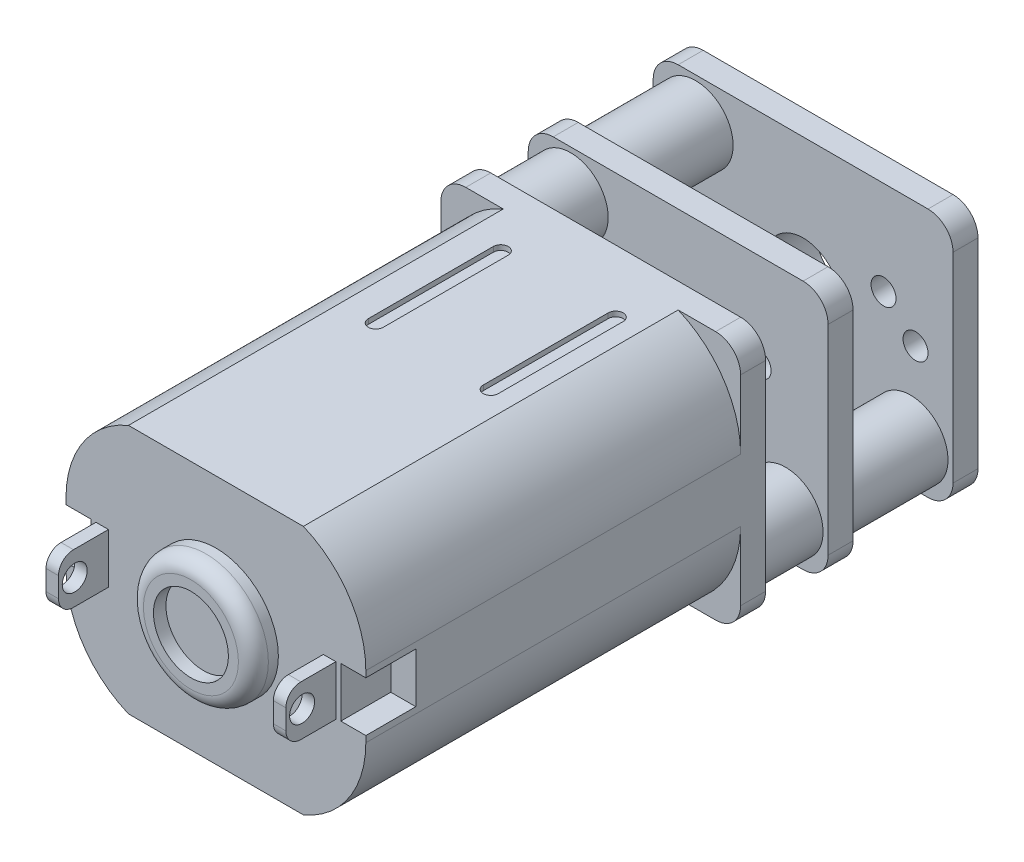
from build123d import *

# Parameters (mm, degrees)
BOSS_EXTRUDE1_DEPTH  = 15
SKETCH2_W            = 12
SKETCH2_H            = 10
BOSS_EXTRUDE2_DEPTH  = 1
FILLET1_R            = 1
SKETCH3_R            = 1
BOSS_EXTRUDE3_DEPTH  = 2
SKETCH4_R            = 1.5
BOSS_EXTRUDE4_DEPTH  = 2.5
SKETCH12_R           = 2.5
BOSS_EXTRUDE11_DEPTH = 1
SKETCH13_R           = 1.5
CUT_EXTRUDE4_DEPTH   = 0.5
FILLET5_R            = 0.6
SKETCH15_W           = 1
SKETCH15_H           = 2
CUT_EXTRUDE5_DEPTH   = 2
CUT_EXTRUDE6_DEPTH   = 0.2
CUT_EXTRUDE7_START   = -0.2
CUT_EXTRUDE7_DEPTH   = 0.2
SKETCH31_W           = 0.5
SKETCH31_H           = 2
BOSS_EXTRUDE16_DEPTH = 2
FILLET9_R            = 0.6
SKETCH32_R           = 0.5
CUT_EXTRUDE10_DEPTH  = 2
CUT_EXTRUDE11_START  = -2
SKETCH33_R           = 0.5
CUT_EXTRUDE11_DEPTH  = 2
BOSS_EXTRUDE17_DEPTH = 1
FILLET10_R           = 1
SKETCH34_R           = 1.5
BOSS_EXTRUDE18_DEPTH = 4
SKETCH35_W           = 12
SKETCH35_H           = 10
BOSS_EXTRUDE19_DEPTH = 1
SKETCH36_R           = 2
BOSS_EXTRUDE20_DEPTH = 1
CUT_EXTRUDE12_START  = -2
SKETCH37_R           = 1.5
CUT_EXTRUDE12_DEPTH  = 2
FILLET11_R           = 1
SKETCH38_R           = 0.5
CUT_EXTRUDE13_DEPTH  = 2
SKETCH39_R           = 0.75
CUT_EXTRUDE14_DEPTH  = 9.3
CHAMFER1_SIZE        = 0.3
SKETCH40_R           = 0.5
CUT_EXTRUDE15_DEPTH  = 1
SKETCH41_R           = 0.5
CUT_EXTRUDE16_DEPTH  = 1
SKETCH42_R           = 0.5
CUT_EXTRUDE17_DEPTH  = 1
SKETCH43_R           = 0.5
CUT_EXTRUDE18_DEPTH  = 1


with BuildPart() as part:
    # Sketch1 → Boss-Extrude1 (new body)
    with BuildSketch(Plane.XY):
        with BuildLine():
            Line((-6, -1.25), (-6, 1.25))
            ThreePointArc((-6, 1.25), (-5.317704321, 3.503469547), (-3.5, 5))
            Line((-3.5, 5), (3.5, 5))
            ThreePointArc((3.5, 5), (5.317704321, 3.503469547), (6, 1.25))
            Line((6, 1.25), (6, -1.25))
            ThreePointArc((6, -1.25), (5.317704321, -3.503469547), (3.5, -5))
            Line((3.5, -5), (-3.5, -5))
            ThreePointArc((-3.5, -5), (-5.317704321, -3.503469547), (-6, -1.25))
        make_face()
    extrude(amount=-BOSS_EXTRUDE1_DEPTH)

    # Sketch2 → Boss-Extrude2 (add)
    with BuildSketch(Plane(origin=(0, 0, -15), x_dir=(-1, 0, 0), z_dir=(0, 0, -1))):
        Rectangle(SKETCH2_W, SKETCH2_H)
    extrude(amount=BOSS_EXTRUDE2_DEPTH)

    # Fillet1
    fillet1_edges = [part.edges().sort_by_distance(p)[0] for p in [
        (6, 5, -15.5),
        (6, -5, -15.5),
        (-6, -5, -15.5),
        (-6, 5, -15.5),
    ]]
    fillet(fillet1_edges, radius=FILLET1_R)

    # Sketch3 → Boss-Extrude3 (add)
    with BuildSketch(Plane(origin=(0, 0, -16), x_dir=(-1, 0, 0), z_dir=(0, 0, -1))):
        Circle(SKETCH3_R)
    extrude(amount=BOSS_EXTRUDE3_DEPTH)

    # Sketch4 → Boss-Extrude4 (add)
    with BuildSketch(Plane(origin=(0, 0, -16), x_dir=(-1, 0, 0), z_dir=(0, 0, -1))):
        with Locations((4.3, 3.3)):
            Circle(SKETCH4_R)
        with Locations((-4.3, -3.3)):
            Circle(SKETCH4_R)
    extrude(amount=BOSS_EXTRUDE4_DEPTH)

    # Sketch12 → Boss-Extrude11 (add)
    with BuildSketch(Plane.XY):
        Circle(SKETCH12_R)
    extrude(amount=BOSS_EXTRUDE11_DEPTH)

    # Sketch13 → Cut-Extrude4 (cut)
    with BuildSketch(Plane.XY.offset(1)):
        Circle(SKETCH13_R)
    extrude(amount=-CUT_EXTRUDE4_DEPTH, mode=Mode.SUBTRACT)

    # Fillet5
    fillet5_edges = [part.edges().sort_by_distance(p)[0] for p in [
        (-2.5, 0, 1),
    ]]
    fillet(fillet5_edges, radius=FILLET5_R)

    # Sketch15 → Cut-Extrude5 (cut)
    with BuildSketch(Plane.XY):
        with Locations((-5.5, 0)):
            Rectangle(SKETCH15_W, SKETCH15_H)
        with Locations((5.5, 0)):
            Rectangle(SKETCH15_W, SKETCH15_H)
    extrude(amount=-CUT_EXTRUDE5_DEPTH, mode=Mode.SUBTRACT)

    # Sketch22 → Cut-Extrude6 (cut)
    with BuildSketch(Plane(origin=(0, 5, 0), x_dir=(1, 0, 0), z_dir=(0, 1, 0))):
        with BuildLine():
            Line((-2.4, 8.5), (-2.4, 13.5))
            ThreePointArc((-2.4, 13.5), (-2.1, 13.8), (-1.8, 13.5))
            Line((-1.8, 13.5), (-1.8, 8.5))
            ThreePointArc((-1.8, 8.5), (-2.1, 8.2), (-2.4, 8.5))
        make_face()
        with BuildLine():
            Line((2.2, 8.5), (2.2, 13.5))
            ThreePointArc((2.2, 13.5), (2.5, 13.8), (2.8, 13.5))
            Line((2.8, 13.5), (2.8, 8.5))
            ThreePointArc((2.8, 8.5), (2.5, 8.2), (2.2, 8.5))
        make_face()
    extrude(amount=-CUT_EXTRUDE6_DEPTH, mode=Mode.SUBTRACT)

    # Sketch23 → Cut-Extrude7 (cut)
    with BuildSketch(Plane.XZ.offset(5).offset(CUT_EXTRUDE7_START)):
        with BuildLine():
            Line((-2.8, -13.5), (-2.8, -8.5))
            ThreePointArc((-2.8, -8.5), (-2.5, -8.2), (-2.2, -8.5))
            Line((-2.2, -8.5), (-2.2, -13.5))
            ThreePointArc((-2.2, -13.5), (-2.5, -13.8), (-2.8, -13.5))
        make_face()
        with BuildLine():
            Line((2.2, -13.5), (2.2, -8.5))
            ThreePointArc((2.2, -8.5), (2.5, -8.2), (2.8, -8.5))
            Line((2.8, -8.5), (2.8, -13.5))
            ThreePointArc((2.8, -13.5), (2.5, -13.8), (2.2, -13.5))
        make_face()
    extrude(amount=CUT_EXTRUDE7_DEPTH, mode=Mode.SUBTRACT)

    # Sketch31 → Boss-Extrude16 (add)
    with BuildSketch(Plane.XY):
        with Locations((-4.55, -0.008606945)):
            Rectangle(SKETCH31_W, SKETCH31_H)
        with Locations((4.55, -0.039338836)):
            Rectangle(SKETCH31_W, SKETCH31_H)
    extrude(amount=BOSS_EXTRUDE16_DEPTH)

    # Fillet9
    fillet9_edges = [part.edges().sort_by_distance(p)[0] for p in [
        (-4.55, -1.008606945, 2),
        (-4.55, 0.991393055, 2),
        (4.55, 0.960661164, 2),
        (4.55, -1.039338836, 2),
    ]]
    fillet(fillet9_edges, radius=FILLET9_R)

    # Sketch32 → Cut-Extrude10 (cut)
    with BuildSketch(Plane.ZY.offset(4.8)):
        with Locations((1.35, 0)):
            Circle(SKETCH32_R)
    extrude(amount=-CUT_EXTRUDE10_DEPTH, mode=Mode.SUBTRACT)

    # Sketch33 → Cut-Extrude11 (cut)
    with BuildSketch(Plane(origin=(4.8, 0, 0), x_dir=(0, 0, -1), z_dir=(1, 0, 0)).offset(CUT_EXTRUDE11_START)):
        with Locations(Location((-1.35, 0, 0), (0, 0, 180))):
            Circle(SKETCH33_R)
    extrude(amount=CUT_EXTRUDE11_DEPTH, mode=Mode.SUBTRACT)

    # Sketch24 → Boss-Extrude17 (add)
    with BuildSketch(Plane(origin=(0, 0, -18.5), x_dir=(-1, 0, 0), z_dir=(0, 0, -1))):
        Polygon((2, -5), (2, 1.11), (6, 1.11), (6, 5), (-6, 5), (-6, -5), align=None)
    extrude(amount=BOSS_EXTRUDE17_DEPTH)

    # Fillet10
    fillet10_edges = [part.edges().sort_by_distance(p)[0] for p in [
        (6, 5, -19),
        (6, -5, -19),
        (-2, -5, -19),
        (-6, 5, -19),
    ]]
    fillet(fillet10_edges, radius=FILLET10_R)

    # Sketch34 → Boss-Extrude18 (add)
    with BuildSketch(Plane(origin=(0, 0, -19.5), x_dir=(-1, 0, 0), z_dir=(0, 0, -1))):
        with Locations((-4.3, -3.3)):
            Circle(SKETCH34_R)
        with Locations((4.3, 3.3)):
            Circle(SKETCH34_R)
    extrude(amount=BOSS_EXTRUDE18_DEPTH)

    # Sketch35 → Boss-Extrude19 (add)
    with BuildSketch(Plane(origin=(0, 0, -23.5), x_dir=(-1, 0, 0), z_dir=(0, 0, -1))):
        Rectangle(SKETCH35_W, SKETCH35_H)
    extrude(amount=BOSS_EXTRUDE19_DEPTH)

    # Sketch36 → Boss-Extrude20 (add)
    with BuildSketch(Plane(origin=(0, 0, -24.5), x_dir=(-1, 0, 0), z_dir=(0, 0, -1))):
        Circle(SKETCH36_R)
    extrude(amount=BOSS_EXTRUDE20_DEPTH)

    # Sketch37 → Cut-Extrude12 (cut)
    with BuildSketch(Plane(origin=(0, 0, -25.5), x_dir=(-1, 0, 0), z_dir=(0, 0, -1)).offset(CUT_EXTRUDE12_START)):
        with Locations(Location((0, 0, 0), (0, 0, 180))):
            Circle(SKETCH37_R)
    extrude(amount=CUT_EXTRUDE12_DEPTH, mode=Mode.SUBTRACT)

    # Fillet11
    fillet11_edges = [part.edges().sort_by_distance(p)[0] for p in [
        (6, 5, -24),
        (6, -5, -24),
        (-6, -5, -24),
        (-6, 5, -24),
    ]]
    fillet(fillet11_edges, radius=FILLET11_R)

    # Sketch38 → Cut-Extrude13 (cut)
    with BuildSketch(Plane(origin=(0, 0, -24.5), x_dir=(-1, 0, 0), z_dir=(0, 0, -1))):
        with Locations((-4.5, 0)):
            Circle(SKETCH38_R)
        with Locations((4.5, 0)):
            Circle(SKETCH38_R)
    extrude(amount=-CUT_EXTRUDE13_DEPTH, mode=Mode.SUBTRACT)

    # Sketch39 → Cut-Extrude14 (cut)
    with BuildSketch(Plane(origin=(0, 0, -24.5), x_dir=(-1, 0, 0), z_dir=(0, 0, -1))):
        with Locations((-4.3, -3.3)):
            Circle(SKETCH39_R)
        with Locations((4.3, 3.3)):
            Circle(SKETCH39_R)
    extrude(amount=-CUT_EXTRUDE14_DEPTH, mode=Mode.SUBTRACT)

    # Chamfer1
    chamfer1_edges = [part.edges().sort_by_distance(p)[0] for p in [
        (5.05, -3.3, -24.5),
        (-3.55, 3.3, -24.5),
    ]]
    chamfer(chamfer1_edges, length=CHAMFER1_SIZE)

    # Sketch40 → Cut-Extrude15 (cut)
    with BuildSketch(Plane(origin=(0, 0, -19.5), x_dir=(-1, 0, 0), z_dir=(0, 0, -1))):
        Circle(SKETCH40_R)
    extrude(amount=-CUT_EXTRUDE15_DEPTH, mode=Mode.SUBTRACT)

    # Sketch41 → Cut-Extrude16 (cut)
    with BuildSketch(Plane(origin=(0, 0, -24.5), x_dir=(-1, 0, 0), z_dir=(0, 0, -1))):
        with Locations((3.22, -1.25)):
            Circle(SKETCH41_R)
        with Locations((-3.22, 1.25)):
            Circle(SKETCH41_R)
    extrude(amount=-CUT_EXTRUDE16_DEPTH, mode=Mode.SUBTRACT)

    # Sketch42 → Cut-Extrude17 (cut)
    with BuildSketch(Plane(origin=(0, 0, -19.5), x_dir=(-1, 0, 0), z_dir=(0, 0, -1))):
        with Locations((-3.22, 1.25)):
            Circle(SKETCH42_R)
    extrude(amount=-CUT_EXTRUDE17_DEPTH, mode=Mode.SUBTRACT)

    # Sketch43 → Cut-Extrude18 (cut)
    with BuildSketch(Plane(origin=(0, 0, -16), x_dir=(-1, 0, 0), z_dir=(0, 0, -1))):
        with Locations((3.22, -1.25)):
            Circle(SKETCH43_R)
    extrude(amount=-CUT_EXTRUDE18_DEPTH, mode=Mode.SUBTRACT)


solid = part.part
